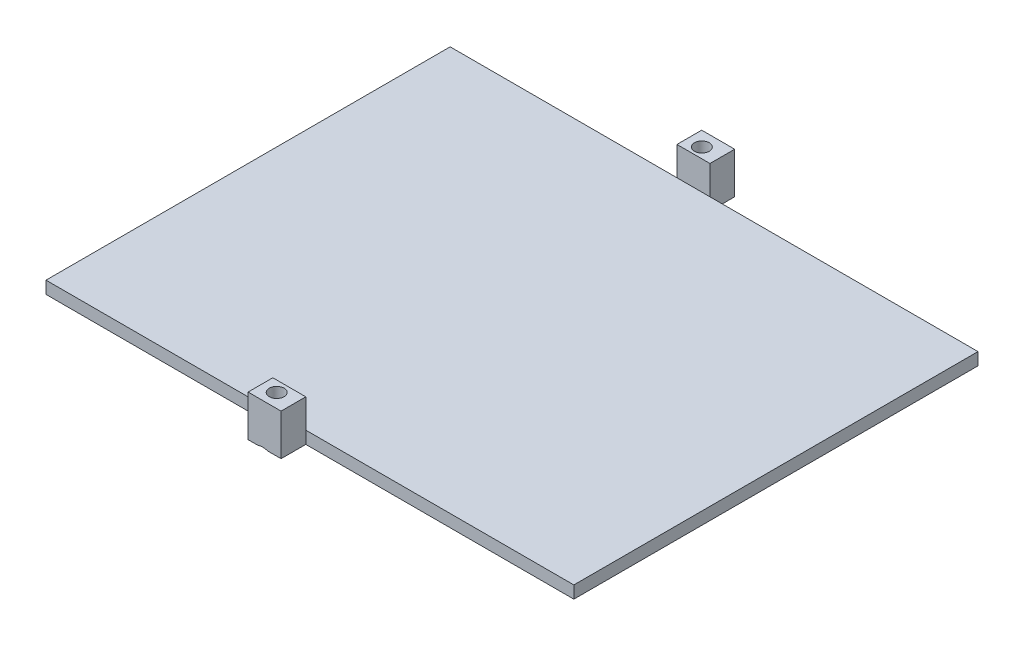
from build123d import *

# Parameters (mm, degrees)
SKETCH1_W                                            = 64
SKETCH1_H                                            = 49
BOSS_EXTRUDE1_DEPTH                                  = 1.5
SKETCH4_W                                            = 4
SKETCH4_H                                            = 3
BOSS_EXTRUDE2_DEPTH                                  = 5
CSK_FOR_M1_6_COUNTERSUNK_FLAT_HEAD_SCREW_D           = 1.8
CSK_FOR_M1_6_COUNTERSUNK_FLAT_HEAD_SCREW_CSINK_D     = 3.6
CSK_FOR_M1_6_COUNTERSUNK_FLAT_HEAD_SCREW_CSINK_ANGLE = 90


with BuildPart() as part:
    # Sketch1 → Boss-Extrude1 (new body)
    with BuildSketch(Plane(origin=(0, 0, 0), x_dir=(1, 0, 0), z_dir=(0, 1, 0))):
        with Locations((32, 24.5)):
            Rectangle(SKETCH1_W, SKETCH1_H)
    extrude(amount=BOSS_EXTRUDE1_DEPTH)

    # Sketch4 → Boss-Extrude2 (add)
    with BuildSketch(Plane(origin=(0, 0, 0), x_dir=(1, 0, 0), z_dir=(0, 1, 0))):
        with Locations((29.5, -1.5)):
            Rectangle(SKETCH4_W, SKETCH4_H)
        with Locations((29.5, 50.5)):
            Rectangle(SKETCH4_W, SKETCH4_H)
    extrude(amount=BOSS_EXTRUDE2_DEPTH)

    # CSK for M1.6 Countersunk Flat Head Screw1 (through all)
    with Locations(Plane(origin=(0, 0, 0), x_dir=(-1, 0, 0), z_dir=(0, -1, 0))):
        with Locations((-29.279045155, 50.23733833), (-29.279045155, -1.306151962)):
            CounterSinkHole(CSK_FOR_M1_6_COUNTERSUNK_FLAT_HEAD_SCREW_D / 2, CSK_FOR_M1_6_COUNTERSUNK_FLAT_HEAD_SCREW_CSINK_D / 2, counter_sink_angle=CSK_FOR_M1_6_COUNTERSUNK_FLAT_HEAD_SCREW_CSINK_ANGLE)


solid = part.part
